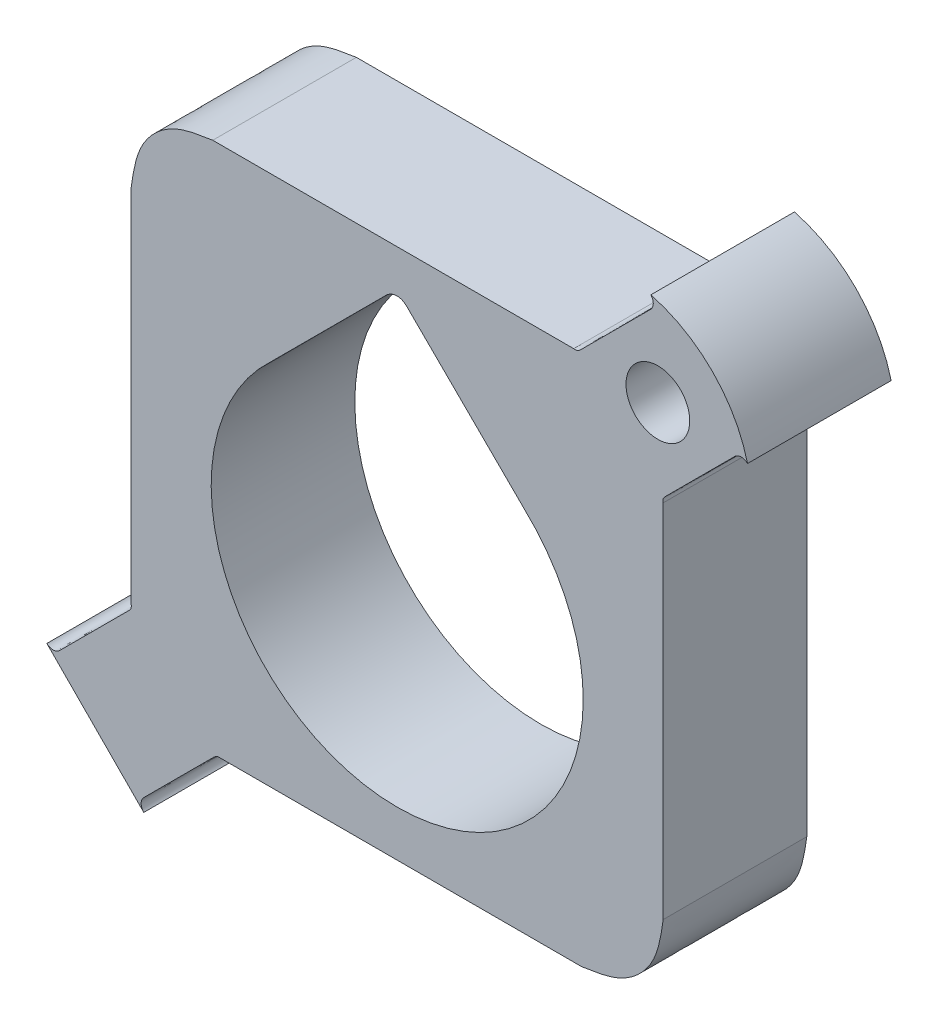
from build123d import *

# Parameters (mm, degrees)
SKETCH2_R           = 1.331799604
BOSS_EXTRUDE1_DEPTH = 6


with BuildPart() as part:
    # Sketch2 → Boss-Extrude1 (new body)
    with BuildSketch(Plane.XY):
        with BuildLine():
            Line((-7.706246934, 57.951214685), (7.372918204, 57.951214685))
            add(Edge.make_bspline(
                [(7.372918204, 57.951214685), (7.395110156, 57.950651705), (7.438614819, 57.949548051), (7.504225261, 57.950625459), (7.555781235, 57.971549168), (7.594142025, 57.993251928), (7.6196821, 58.014176428), (7.635431909, 58.027775879), (7.643125702, 58.03441922)],
                knots=[0, 0, 0, 0, 0.227492727, 0.445972237, 0.663373124, 0.787115425, 0.896005733, 1, 1, 1, 1], degree=3))
            Line((7.643125702, 58.03441922), (10.59644992, 60.987402087))
            add(Edge.make_bspline(
                [(10.59644992, 60.987402087), (10.625456983, 61.026663762), (10.683538077, 61.105277754), (10.707695299, 61.253447318), (10.680583073, 61.389397251), (10.630907962, 61.470381818), (10.600692174, 61.504449729), (10.59644991, 61.50900292)],
                knots=[0, 0, 0, 0, 0.104345134, 0.208931166, 0.313565445, 0.39799532, 0.411364921, 0.411364921, 0.411364921, 0.411364921], degree=3))
            ThreePointArc((10.59644991, 61.50900292), (13.175131131, 60.020629535), (14.637581092, 57.427158448))
            add(Edge.make_bspline(
                [(14.637581092, 57.427158448), (14.63281413, 57.431646623), (14.598617329, 57.462223659), (14.517454165, 57.512357762), (14.3814295, 57.53955279), (14.232961651, 57.515207684), (14.154478031, 57.456521872), (14.115208769, 57.42715844)],
                knots=[0.58753787, 0.58753787, 0.58753787, 0.58753787, 0.601601228, 0.686034701, 0.790672378, 0.895262972, 1, 1, 1, 1], degree=3))
            Line((14.115208769, 57.42715844), (11.198386433, 54.510673236))
            add(Edge.make_bspline(
                [(11.198386433, 54.510673236), (11.189737643, 54.50058532), (11.172712209, 54.480726918), (11.146988546, 54.45027591), (11.11992052, 54.414228702), (11.108014065, 54.36337785), (11.109113984, 54.30464265), (11.112305892, 54.263909284), (11.114003119, 54.242250215)],
                knots=[0, 0, 0, 0, 0.134581529, 0.264928249, 0.404990742, 0.58604785, 0.779890073, 1, 1, 1, 1], degree=3))
            Line((11.114003119, 54.242250215), (11.114003119, 39.164130765))
            add(Edge.make_bspline(
                [(11.114003119, 39.164130765), (11.026069958, 38.560039142), (10.85421565, 37.379418015), (9.491383713, 36.016723245), (8.31051879, 35.844259059), (7.706108935, 35.755985581)],
                knots=[0, 0, 0, 0, 0.33840601, 0.661371999, 1, 1, 1, 1], degree=3))
            Line((7.706108935, 35.755985581), (-7.3716965, 35.755985581))
            add(Edge.make_bspline(
                [(-7.3716965, 35.755985581), (-7.390791848, 35.757243364), (-7.42588813, 35.759555105), (-7.480435634, 35.756767712), (-7.526608025, 35.741130321), (-7.568839822, 35.721664455), (-7.605836087, 35.699368029), (-7.62980257, 35.681485074), (-7.642317826, 35.672146626)],
                knots=[0, 0, 0, 0, 0.196745559, 0.361608386, 0.557261599, 0.692766378, 0.839563136, 1, 1, 1, 1], degree=3))
            Line((-7.642317826, 35.672146626), (-10.595729808, 32.719076005))
            add(Edge.make_bspline(
                [(-10.595729808, 32.719076005), (-10.624701104, 32.679767795), (-10.682693852, 32.601083323), (-10.706716869, 32.452917901), (-10.679538616, 32.31693156), (-10.627669532, 32.232998542), (-10.594437458, 32.196738778), (-10.58754182, 32.189777291)],
                knots=[0, 0, 0, 0, 0.104384754, 0.208950226, 0.313569176, 0.398093487, 0.419151196, 0.419151196, 0.419151196, 0.419151196], degree=3))
            Line((-10.58754182, 32.189777291), (-14.637683818, 36.278595616))
            add(Edge.make_bspline(
                [(-14.637683818, 36.278595616), (-14.633122591, 36.274312936), (-14.5989743, 36.243764471), (-14.518175826, 36.193440108), (-14.381934797, 36.166179863), (-14.233405716, 36.190514922), (-14.154618978, 36.249229011), (-14.11521277, 36.278595623)],
                knots=[0.587566394, 0.587566394, 0.587566394, 0.587566394, 0.601007159, 0.685956809, 0.790142009, 0.895036806, 1, 1, 1, 1], degree=3))
            Line((-14.11521277, 36.278595623), (-11.198029632, 39.195441586))
            add(Edge.make_bspline(
                [(-11.198029632, 39.195441586), (-11.190093681, 39.205582441), (-11.174520458, 39.225482487), (-11.15027016, 39.255165521), (-11.125422855, 39.293499099), (-11.110689079, 39.344394677), (-11.107300881, 39.404327233), (-11.111709764, 39.443939019), (-11.114003119, 39.464543755)],
                knots=[0, 0, 0, 0, 0.131285455, 0.257629811, 0.390972346, 0.594165008, 0.788898108, 1, 1, 1, 1], degree=3))
            Line((-11.114003119, 39.464543755), (-11.114003119, 54.542930501))
            add(Edge.make_bspline(
                [(-11.114003119, 54.542930501), (-11.025772384, 55.146864843), (-10.853333144, 56.327201592), (-9.491346414, 57.690256382), (-8.310575854, 57.862869665), (-7.706246934, 57.951214685)],
                knots=[0, 0, 0, 0, 0.338409749, 0.6613922, 1, 1, 1, 1], degree=3))
        make_face()
        with Locations((10.890728729, 57.759012308)):
            Circle(SKETCH2_R, mode=Mode.SUBTRACT)
        with BuildLine():
            Line((-0.443808512, 55.984274583), (-5.297244805, 51.131120289))
            ThreePointArc((-5.297244805, 51.131120289), (0, 37.672973009), (5.297244805, 51.131120289))
            Line((5.297244805, 51.131120289), (0.407829784, 55.984274583))
            add(Edge.make_bspline(
                [(0.407829784, 55.984274583), (0.368694639, 56.018150383), (0.291347372, 56.085103007), (0.15161935, 56.154367662), (0.050542727, 56.164189345), (5.56e-05, 56.169095213)],
                knots=[0, 0, 0, 0, 0.338885039, 0.6697773, 1, 1, 1, 1], degree=3))
            add(Edge.make_bspline(
                [(5.56e-05, 56.169095213), (-0.05257804, 56.164008855), (-0.160972548, 56.153533933), (-0.315204963, 56.089735455), (-0.401165502, 56.019243828), (-0.443808512, 55.984274583)],
                knots=[0, 0, 0, 0, 0.322338023, 0.663827768, 1, 1, 1, 1], degree=3))
        make_face(mode=Mode.SUBTRACT)
    extrude(amount=BOSS_EXTRUDE1_DEPTH)


solid = part.part
